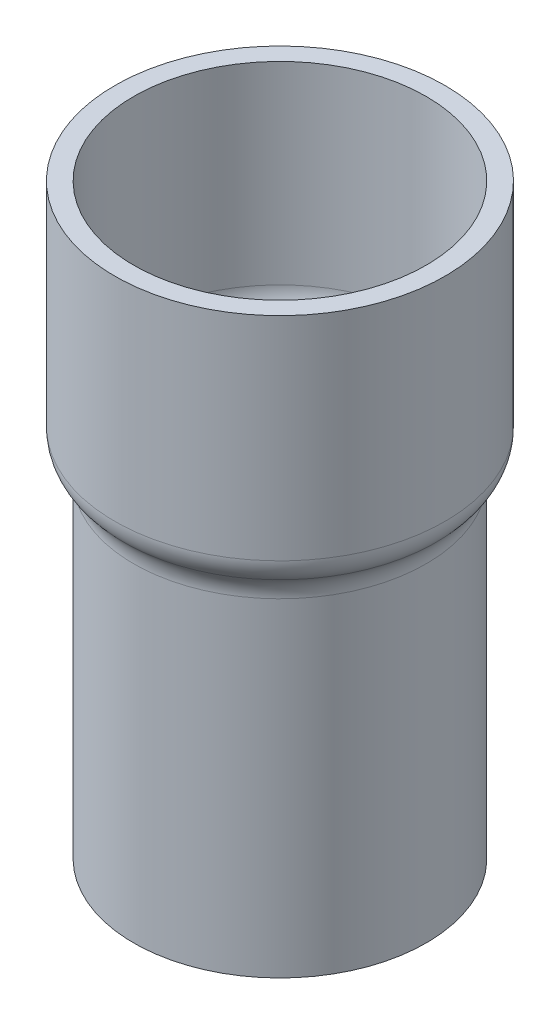
from build123d import *


with BuildPart() as part:
    # Sketch1 → Revolve1 (revolve)
    with BuildSketch(Plane.XY, mode=Mode.PRIVATE) as revolve1_sk:
        with BuildLine():
            Line((-1.35, 0), (-1.35, 3.68))
            ThreePointArc((-1.35, 3.68), (-1.376012653, 3.812409209), (-1.450183993, 3.92513662))
            ThreePointArc((-1.450183993, 3.92513662), (-1.524082894, 4.037449972), (-1.55, 4.16937283))
            Line((-1.55, 4.16937283), (-1.55, 6.22))
            Line((-1.55, 6.22), (-1.75, 6.22))
            Line((-1.75, 6.22), (-1.75, 3.96937283))
            ThreePointArc((-1.75, 3.96937283), (-1.724082894, 3.837449972), (-1.650183993, 3.72513662))
            ThreePointArc((-1.650183993, 3.72513662), (-1.576012653, 3.612409209), (-1.55, 3.48))
            Line((-1.55, 3.48), (-1.55, 0))
            Line((-1.55, 0), (-1.35, 0))
        make_face()
    revolve(revolve1_sk.sketch.rotate(Axis((0, 0, 0), (0, 1, 0)), 270), axis=Axis((0, 0, 0), (0, 1, 0)))


solid = part.part
